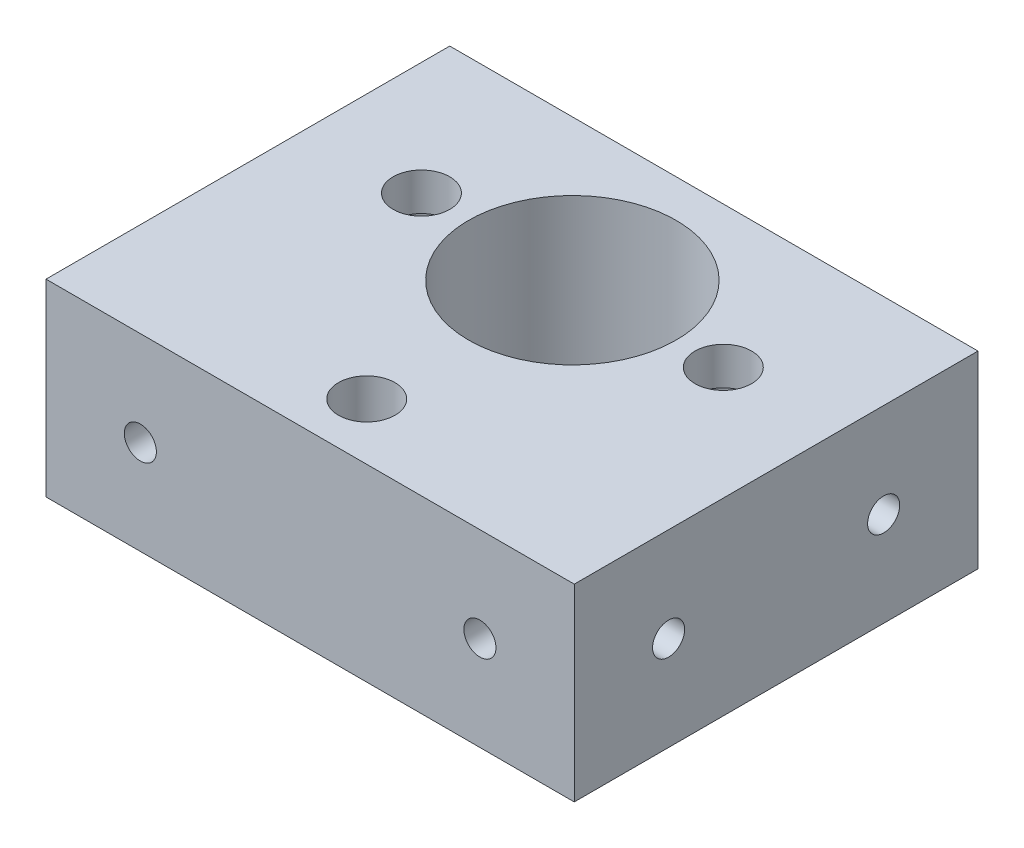
from build123d import *

# Parameters (mm, degrees)
SKETCH_1_W          = 28
SKETCH_1_H          = 21.4
SKETCH_1_R          = 1.5
EXTRUDE_1_DEPTH     = 10
SKETCH_1_17_R       = 2.25
CUT_EXTRUDE_5_DEPTH = 8
CUT_EXTRUDE_START   = 14
SKETCH_2_R          = 0.85
CUT_EXTRUDE_1_DEPTH = 4
CUT_EXTRUDE_START_2 = -10
SKETCH_2_2_R        = 0.85
CUT_EXTRUDE_2_DEPTH = 4
CUT_EXTRUDE_START_3 = 13.9
SKETCH_3_R          = 0.85
CUT_EXTRUDE_3_DEPTH = 4
CUT_EXTRUDE_START_4 = -3.5
SKETCH_3_2_R        = 0.85
CUT_EXTRUDE_4_DEPTH = 4


with BuildPart() as part:
    # 草图1 → 凸台-拉伸1 (new body)
    with BuildSketch(Plane(origin=(0, 0, 0), x_dir=(1, 0, 0), z_dir=(0, 1, 0))):
        with Locations((0, -3.2)):
            Rectangle(SKETCH_1_W, SKETCH_1_H)
        with Locations(Location((-8, 0, 0), (0, 0, 270))):
            Circle(SKETCH_1_R, mode=Mode.SUBTRACT)
        with BuildLine():
            ThreePointArc((5.5, 0), (0, -5.5), (-5.5, 0))
            ThreePointArc((-5.5, 0), (0, 5.5), (5.5, 0))
        make_face(mode=Mode.SUBTRACT)
        with Locations(Location((8, 0, 0), (0, 0, 270))):
            Circle(SKETCH_1_R, mode=Mode.SUBTRACT)
        with Locations(Location((0, -10.9, 0), (0, 0, 270))):
            Circle(SKETCH_1_R, mode=Mode.SUBTRACT)
    extrude(amount=EXTRUDE_1_DEPTH)

    # 草图1<17> → 切除-拉伸5 (cut)
    with BuildSketch(Plane(origin=(0, 0, 0), x_dir=(1, 0, 0), z_dir=(0, 1, 0))):
        with Locations(Location((-8, 0, 0), (0, 0, 270))):
            Circle(SKETCH_1_17_R)
        with Locations(Location((8, 0, 0), (0, 0, 270))):
            Circle(SKETCH_1_17_R)
    extrude(amount=CUT_EXTRUDE_5_DEPTH, mode=Mode.SUBTRACT)

    # 草图2 → 切除-拉伸1 (cut)
    with BuildSketch(Plane(origin=(0, 0, 0), x_dir=(0, 0, -1), z_dir=(1, 0, 0)).offset(CUT_EXTRUDE_START)):
        with Locations(Location((-8.9, 5, 0), (0, 0, 180))):
            Circle(SKETCH_2_R)
        with Locations(Location((2.5, 5, 0), (0, 0, 180))):
            Circle(SKETCH_2_R)
    extrude(amount=-CUT_EXTRUDE_1_DEPTH, mode=Mode.SUBTRACT)

    # 草图2<2> → 切除-拉伸2 (cut)
    with BuildSketch(Plane(origin=(0, 0, 0), x_dir=(0, 0, -1), z_dir=(1, 0, 0)).offset(CUT_EXTRUDE_START_2)):
        with Locations(Location((-8.9, 5, 0), (0, 0, 180))):
            Circle(SKETCH_2_2_R)
        with Locations(Location((2.5, 5, 0), (0, 0, 180))):
            Circle(SKETCH_2_2_R)
    extrude(amount=-CUT_EXTRUDE_2_DEPTH, mode=Mode.SUBTRACT)

    # 草图3 → 切除-拉伸3 (cut)
    with BuildSketch(Plane.XY.offset(CUT_EXTRUDE_START_3)):
        with Locations((-9, 5)):
            Circle(SKETCH_3_R)
        with Locations((9, 5)):
            Circle(SKETCH_3_R)
    extrude(amount=-CUT_EXTRUDE_3_DEPTH, mode=Mode.SUBTRACT)

    # 草图3<2> → 切除-拉伸4 (cut)
    with BuildSketch(Plane.XY.offset(CUT_EXTRUDE_START_4)):
        with Locations((-9, 5)):
            Circle(SKETCH_3_2_R)
        with Locations((9, 5)):
            Circle(SKETCH_3_2_R)
    extrude(amount=-CUT_EXTRUDE_4_DEPTH, mode=Mode.SUBTRACT)


solid = part.part
